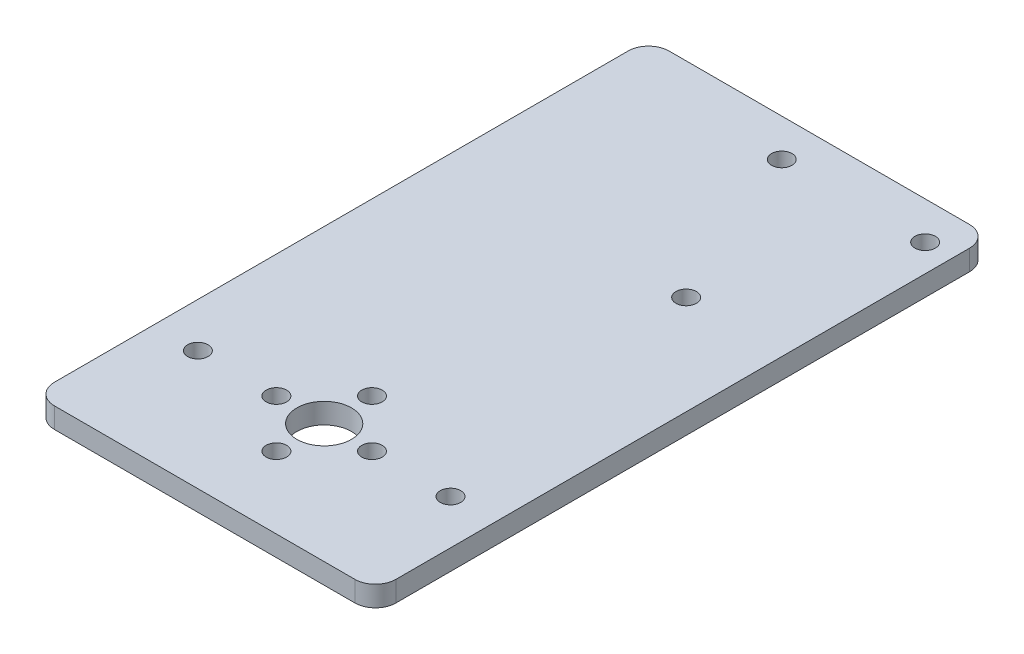
from build123d import *

# Parameters (mm, degrees)
SKETCH_1_R      = 1.5
SKETCH_1_R_2    = 4
EXTRUDE_1_DEPTH = 3
FILLET_2_R      = 3


with BuildPart() as part:
    # 草图1 → 凸台-拉伸1 (new body)
    with BuildSketch(Plane(origin=(0, 0, 0), x_dir=(1, 0, 0), z_dir=(0, 1, 0))):
        Polygon((25, 17.5), (25, -27.5), (-25, -27.5), (-25, 17.5), (-25, 62.5), (25, 62.5), align=None)
        with Locations(Location((0, 57, 0), (0, 0, 270))):
            Circle(SKETCH_1_R, mode=Mode.SUBTRACT)
        with Locations(Location((10.5, 32.5, 0), (0, 0, 270))):
            Circle(SKETCH_1_R, mode=Mode.SUBTRACT)
        with Locations(Location((21, 57, 0), (0, 0, 270))):
            Circle(SKETCH_1_R, mode=Mode.SUBTRACT)
        with Locations(Location((0, -10, 0), (0, 0, 270))):
            Circle(SKETCH_1_R_2, mode=Mode.SUBTRACT)
        with Locations(Location((0, -3, 0), (0, 0, 270))):
            Circle(SKETCH_1_R, mode=Mode.SUBTRACT)
        with Locations(Location((-18.5, -10, 0), (0, 0, 270))):
            Circle(SKETCH_1_R, mode=Mode.SUBTRACT)
        with Locations(Location((18.5, -10, 0), (0, 0, 270))):
            Circle(SKETCH_1_R, mode=Mode.SUBTRACT)
        with Locations(Location((7, -10, 0), (0, 0, 270))):
            Circle(SKETCH_1_R, mode=Mode.SUBTRACT)
        with Locations(Location((0, -17, 0), (0, 0, 270))):
            Circle(SKETCH_1_R, mode=Mode.SUBTRACT)
        with Locations(Location((-7, -10, 0), (0, 0, 270))):
            Circle(SKETCH_1_R, mode=Mode.SUBTRACT)
    extrude(amount=EXTRUDE_1_DEPTH)

    # 圆角2
    fillet_2_edges = [part.edges().sort_by_distance(p)[0] for p in [
        (25, 1.5, 27.5),
        (-25, 1.5, 27.5),
        (-25, 1.5, -62.5),
        (25, 1.5, -62.5),
    ]]
    fillet(fillet_2_edges, radius=FILLET_2_R)


solid = part.part
